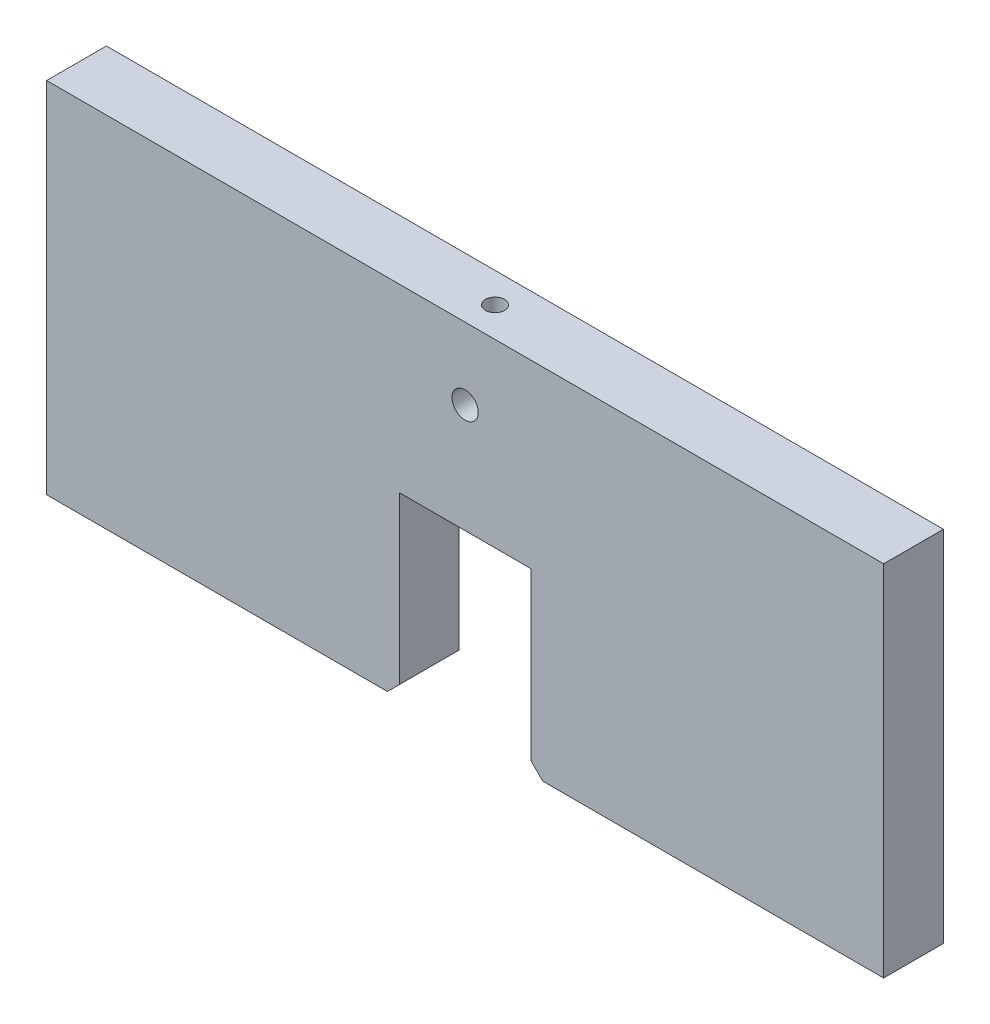
from build123d import *

# Parameters (mm, degrees)
BOSS_EXTRUDE1_DEPTH     = 25
CUT_EXTRUDE1_DEPTH      = 421.885618285
CUT_EXTRUDE1_DEPTH_BACK = 421.885618285
SKETCH2_R               = 11
SKETCH3_R               = 8
CUT_EXTRUDE2_DEPTH      = 35
SKETCH4_R               = 8
CUT_EXTRUDE3_DEPTH      = 30


with BuildPart() as part:
    # Sketch1 → Boss-Extrude1 (new, symmetric)
    with BuildSketch(Plane.XY):
        Polygon((350, 232.421392473), (-350, 232.421392473), (-350, -67.578607527), (-65, -67.578607527), (-55, -57.578607527), (-55, 81.421392473), (55, 81.421392473), (55, -57.578607527), (65, -67.578607527), (350, -67.578607527), align=None)
    extrude(amount=BOSS_EXTRUDE1_DEPTH, both=True)

    # Sketch2 → Cut-Extrude1 (cut, two sides: drawn at the far end of the back side and taken through both)
    with BuildSketch(Plane.XY.offset(-CUT_EXTRUDE1_DEPTH_BACK)):
        with Locations((0, 172.421392473)):
            Circle(SKETCH2_R)
    extrude(amount=CUT_EXTRUDE1_DEPTH + CUT_EXTRUDE1_DEPTH_BACK, mode=Mode.SUBTRACT)

    # Sketch3 → Cut-Extrude2 (cut)
    with BuildSketch(Plane(origin=(0, 232.421392473, 0), x_dir=(1, 0, 0), z_dir=(0, 1, 0))):
        with Locations(Location((0, 0, 0), (0, 0, 270))):
            Circle(SKETCH3_R)
    extrude(amount=-CUT_EXTRUDE2_DEPTH, mode=Mode.SUBTRACT)

    # Sketch4 → Cut-Extrude3 (cut)
    with BuildSketch(Plane.XZ.offset(67.578607527)):
        with Locations((-80, 0)):
            Circle(SKETCH4_R)
        with Locations((80, 0)):
            Circle(SKETCH4_R)
    extrude(amount=-CUT_EXTRUDE3_DEPTH, mode=Mode.SUBTRACT)


solid = part.part
